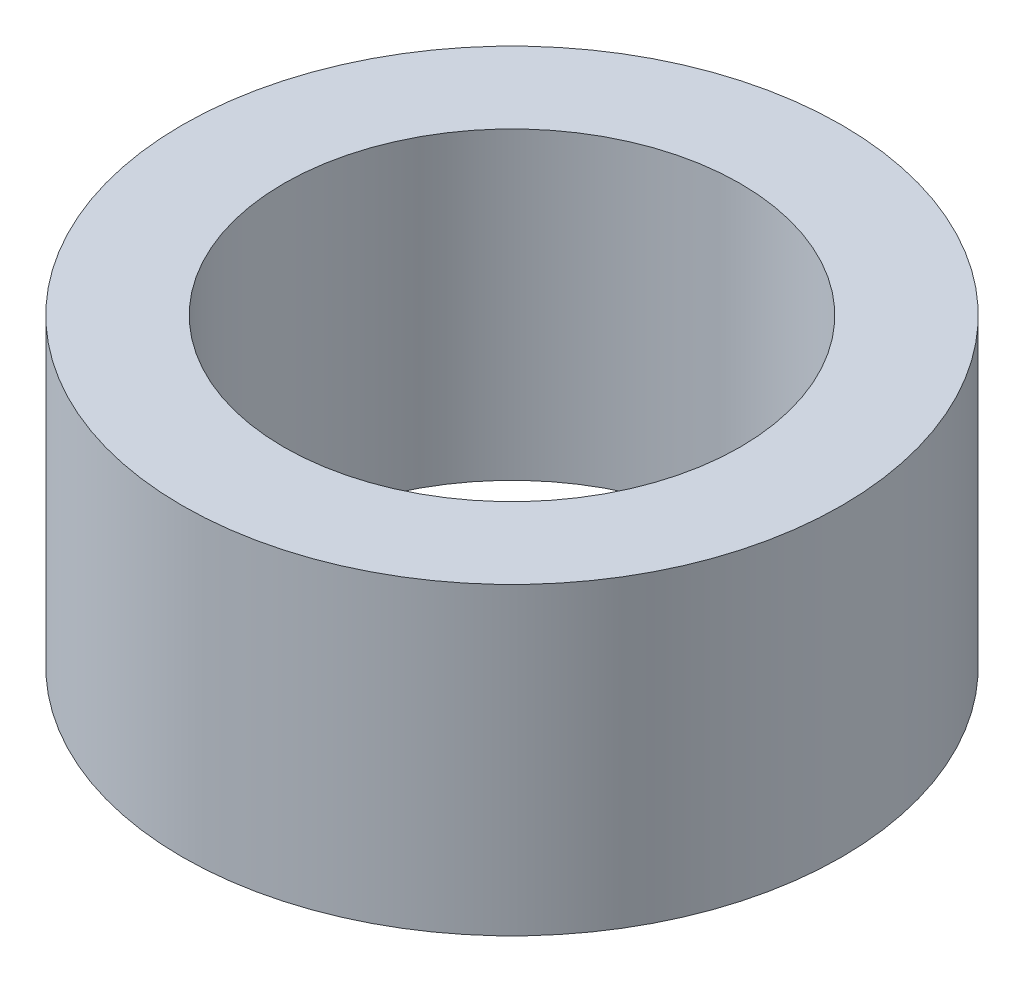
from build123d import *

# Parameters (mm, degrees)
SKETCH1_R           = 3.25
SKETCH1_R_2         = 2.25
BOSS_EXTRUDE1_DEPTH = 3


with BuildPart() as part:
    # Sketch1 → Boss-Extrude1 (new body)
    with BuildSketch(Plane(origin=(0, 0, 0), x_dir=(1, 0, 0), z_dir=(0, 1, 0))):
        with Locations(Location((0, 0, 0), (0, 0, 270))):
            Circle(SKETCH1_R)
        with Locations(Location((0, 0, 0), (0, 0, 270))):
            Circle(SKETCH1_R_2, mode=Mode.SUBTRACT)
    extrude(amount=BOSS_EXTRUDE1_DEPTH)


solid = part.part
